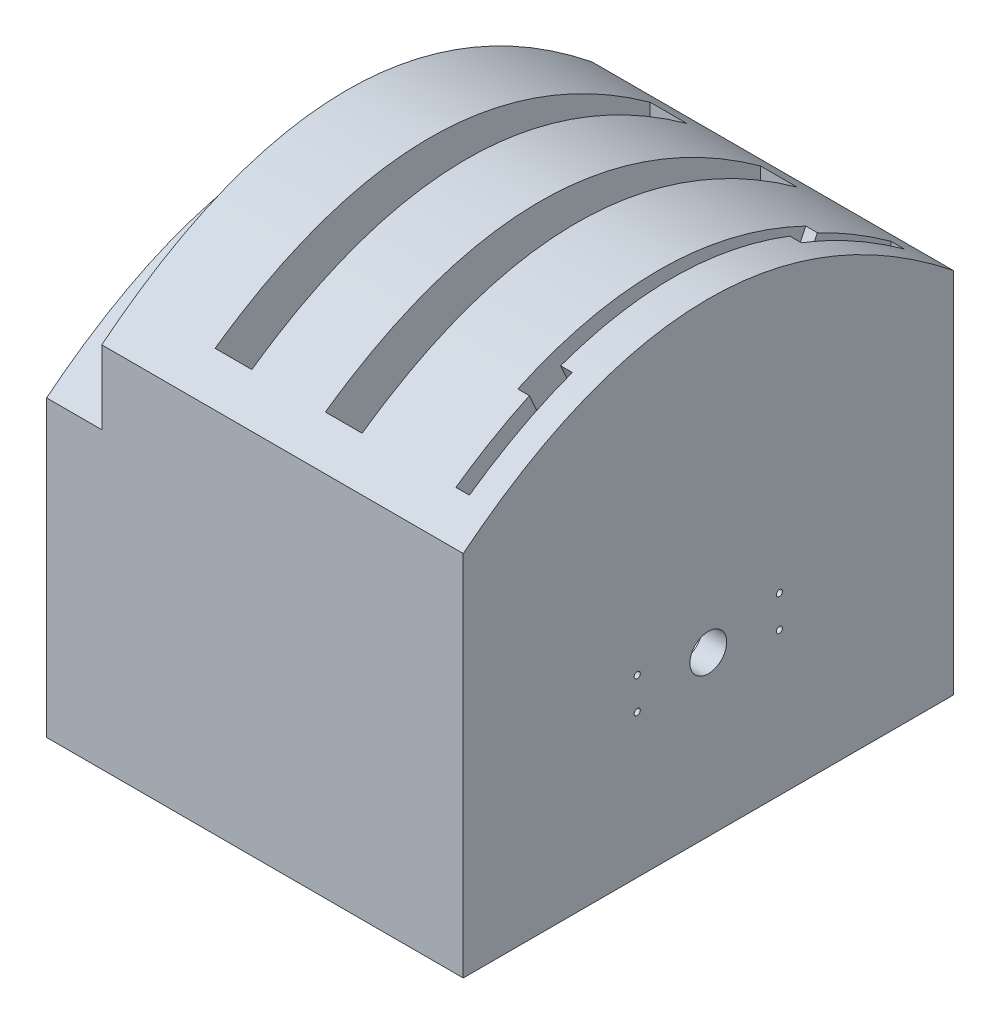
from build123d import *

# Parameters (mm, degrees)
BASE_DEPTH           = 170
FLAPS_CUT_DEPTH      = 190
SKETCH3_W            = 15
SKETCH3_H            = 177.5
THROTTLE_CUT_DEPTH   = 190
SKETCH4_W            = 12.5
SKETCH4_H            = 175
WING_SWEEP_CUT_DEPTH = 190
SKETCH7_W            = 150
SKETCH7_H            = 177.5
BOTTOM_CUT_DEPTH     = 140
CUT_EXTRUDE1_START   = -170
SKETCH6_R            = 7.5
CUT_EXTRUDE1_DEPTH   = 10
SKETCH8_R            = 1.25
CUT_EXTRUDE3_DEPTH   = 10
CUT_EXTRUDE10_DEPTH  = 4.75
BOSS_EXTRUDE5_START  = 10.25
BOSS_EXTRUDE5_DEPTH  = 4.75
CUT_EXTRUDE4_REACH   = 235.506
SKETCH13_W           = 10
SKETCH13_H           = 177.5
BOSS_EXTRUDE2_DEPTH  = 140
BOSS_EXTRUDE1_DEPTH  = 2.5
CUT_EXTRUDE5_START   = 12.5
SKETCH10_R           = 7.5
CUT_EXTRUDE5_DEPTH   = 10
SKETCH14_R           = 5
CUT_EXTRUDE6_DEPTH   = 10
SKETCH16_R           = 1.25
CUT_EXTRUDE9_DEPTH   = 10
BOSS_EXTRUDE3_DEPTH  = 2.5
BOSS_EXTRUDE4_DEPTH  = 2.5
FILLET1_R            = 2.5


with BuildPart() as part:
    # Sketch1 → Base (new body)
    with BuildSketch(Plane(origin=(0, 0, 0), x_dir=(0, 0, -1), z_dir=(1, 0, 0))):
        with BuildLine():
            Line((-100, 85), (-100, -65))
            Line((-100, -65), (100, -65))
            Line((100, -65), (100, 85))
            add(Edge.make_bspline(
                [(-100, 85), (0, 165), (100, 85)],
                knots=[0, 0, 0, 1, 1, 1], degree=2))
        make_face()
    extrude(amount=BASE_DEPTH)

    # Sketch5 → Flaps Cut (cut)
    with BuildSketch(Plane(origin=(0, 125, 0), x_dir=(1, 0, 0), z_dir=(0, 1, 0))):
        Polygon((160, 90), (154.5, 90), (154.5, 60), (149.75, 60), (149.75, -57.5), (154.5, -57.5), (154.5, -87.5), (160, -87.5), (160, -45.5), (155.25, -45.5), (155.25, 48), (160, 48), align=None)
    extrude(amount=-FLAPS_CUT_DEPTH, mode=Mode.SUBTRACT)

    # Sketch3 → Throttle Cut (cut)
    with BuildSketch(Plane(origin=(0, 125, 0), x_dir=(1, 0, 0), z_dir=(0, 1, 0))):
        with Locations((108.75, 1.25)):
            Rectangle(SKETCH3_W, SKETCH3_H)
        with Locations((63.75, 1.25)):
            Rectangle(SKETCH3_W, SKETCH3_H)
    extrude(amount=-THROTTLE_CUT_DEPTH, mode=Mode.SUBTRACT)

    # Sketch4 → Wing Sweep Cut (cut)
    with BuildSketch(Plane(origin=(0, 125, 0), x_dir=(1, 0, 0), z_dir=(0, 1, 0))):
        with Locations((16.25, 0)):
            Rectangle(SKETCH4_W, SKETCH4_H)
    extrude(amount=-WING_SWEEP_CUT_DEPTH, mode=Mode.SUBTRACT)

    # Sketch7 → Bottom Cut (cut)
    with BuildSketch(Plane.XZ.offset(65)):
        with Locations((85, -1.25)):
            Rectangle(SKETCH7_W, SKETCH7_H)
    extrude(amount=-BOTTOM_CUT_DEPTH, mode=Mode.SUBTRACT)

    # Sketch6 → Cut-Extrude1 (cut)
    with BuildSketch(Plane.ZY.offset(CUT_EXTRUDE1_START)):
        with Locations(Location((0, 0, 0), (0, 0, 180))):
            Circle(SKETCH6_R)
    extrude(amount=CUT_EXTRUDE1_DEPTH, mode=Mode.SUBTRACT)

    # Sketch8 → Cut-Extrude3 (cut)
    with BuildSketch(Plane(origin=(170, 0, 0), x_dir=(0, 0, -1), z_dir=(1, 0, 0))):
        with Locations((-29, 6.5)):
            Circle(SKETCH8_R)
        with Locations((29, 6.5)):
            Circle(SKETCH8_R)
        with Locations(Location((29, -6.5, 0), (0, 0, 180))):
            Circle(SKETCH8_R)
        with Locations(Location((-29, -6.5, 0), (0, 0, 180))):
            Circle(SKETCH8_R)
    extrude(amount=-CUT_EXTRUDE3_DEPTH, mode=Mode.SUBTRACT)

    # Sketch20 → Cut-Extrude10 (cut)
    with BuildSketch(Plane.ZY.offset(-155.25)):
        Polygon((45.5, 116.719), (23, 66.719), (45.5, 66.719), align=None)
        Polygon((-48, 115.784), (-48, 65.784), (-24.5, 65.784), align=None)
    extrude(amount=-CUT_EXTRUDE10_DEPTH, mode=Mode.SUBTRACT)

    # Sketch22 → Boss-Extrude5 (add)
    with BuildSketch(Plane.ZY.offset(-160).offset(BOSS_EXTRUDE5_START)):
        Polygon((-60, 110.6), (-43, 75), (-60, 75), align=None)
        Polygon((57.5, 111.775), (57.5, 75), (41.25, 75), align=None)
    extrude(amount=-BOSS_EXTRUDE5_DEPTH)

    # Cut-Extrude4: up to this face of the body (flat: up to its plane)
    cut_extrude4_end = Plane(part.part.faces().sort_by_distance((22.5, 95.943389409, 0))[0])
    # Sketch9 → Cut-Extrude4 (cut, up to the picked face)
    with BuildSketch(Plane.ZY, mode=Mode.PRIVATE) as cut_extrude4_sk1:
        with BuildLine():
            Line((-100, 55), (-100, 135))
            Line((-100, 135), (100, 135))
            Line((100, 135), (100, 55))
            add(Edge.make_bspline(
                [(-100, 55), (0, 135), (100, 55)],
                knots=[0, 0, 0, 1, 1, 1], degree=2))
        make_face()
    cut_extrude4_tool1 = split(extrude(cut_extrude4_sk1.sketch, amount=-CUT_EXTRUDE4_REACH, mode=Mode.PRIVATE), bisect_by=cut_extrude4_end, keep=Keep.BOTH, mode=Mode.PRIVATE)
    add(cut_extrude4_tool1.solids().sort_by(Axis((0, 107, 0), (1, 0, 0)))[0], mode=Mode.SUBTRACT)

    # Sketch13 → Boss-Extrude2 (add)
    with BuildSketch(Plane.XZ.offset(-75)):
        with Locations((27.5, -1.25)):
            Rectangle(SKETCH13_W, SKETCH13_H)
    extrude(amount=BOSS_EXTRUDE2_DEPTH)

    # Sketch12 → Boss-Extrude1 (add)
    with BuildSketch(Plane.ZY.offset(-22.5)):
        with BuildLine():
            Line((-48.430896929, 58.27583397), (-48.430896929, 55.27583397))
            add(Edge.make_bspline(
                [(100, 24.75), (53.034936091, 64.414476941), (3.557970448, 74.589754931), (-48.430896929, 55.27583397)],
                knots=[0, 0, 0, 0, 0.968984133, 0.968984133, 0.968984133, 0.968984133], degree=3))
            Line((100, 24.75), (100, 27.75))
            add(Edge.make_bspline(
                [(-48.430896929, 58.27583397), (3.557970448, 77.589754931), (53.034936091, 67.414476941), (100, 27.75)],
                knots=[0.031015867, 0.031015867, 0.031015867, 0.031015867, 1, 1, 1, 1], degree=3))
        make_face()
    extrude(amount=BOSS_EXTRUDE1_DEPTH)

    # Sketch10 → Cut-Extrude5 (cut)
    with BuildSketch(Plane(origin=(10, 0, 0), x_dir=(0, 0, -1), z_dir=(1, 0, 0)).offset(CUT_EXTRUDE5_START)):
        with Locations(Location((0, -30, 0), (0, 0, 180))):
            Circle(SKETCH10_R)
    extrude(amount=CUT_EXTRUDE5_DEPTH, mode=Mode.SUBTRACT)

    # Sketch14 → Cut-Extrude6 (cut)
    with BuildSketch(Plane.ZY.offset(-22.5)):
        with Locations((47.461085944, -24.937811516)):
            Circle(SKETCH14_R)
    extrude(amount=-CUT_EXTRUDE6_DEPTH, mode=Mode.SUBTRACT)

    # Sketch16 → Cut-Extrude9 (cut)
    with BuildSketch(Plane.ZY.offset(-22.5)):
        with Locations((80, -55)):
            Circle(SKETCH16_R)
        with Locations((15, -55)):
            Circle(SKETCH16_R)
        with Locations(Location((15, 0, 0), (0, 0, 180))):
            Circle(SKETCH16_R)
        with Locations(Location((80, 0, 0), (0, 0, 180))):
            Circle(SKETCH16_R)
    extrude(amount=-CUT_EXTRUDE9_DEPTH, mode=Mode.SUBTRACT)

    # Sketch17 → Boss-Extrude3 (add)
    with BuildSketch(Plane.ZY.offset(-22.5)):
        Polygon((-49.779698587, 57.845518251), (-56.564154309, 70.770998519), (-59.220468232, 69.376725826), (-51.087210852, 53.881561277), (-48.430896929, 55.27583397), (-48.430896929, 58.27583397), align=None)
    extrude(amount=BOSS_EXTRUDE3_DEPTH)

    # Sketch19 → Boss-Extrude4 (add)
    with BuildSketch(Plane.ZY.offset(-22.5)):
        with BuildLine():
            Line((-55.75633725, 69.231976984), (-56.913289215, 71.693559969))
            add(Edge.make_bspline(
                [(-100, 45.5), (-77.538087055, 61.999838272), (-56.913289215, 71.693559969)],
                knots=[0, 0, 0, 0.206247978, 0.206247978, 0.206247978], degree=2))
            Line((-100, 45.5), (-100, 42.5))
            add(Edge.make_bspline(
                [(-100, 42.5), (-76.959611073, 59.462619059), (-55.75633725, 69.231976984)],
                knots=[0, 0, 0, 0.212032738, 0.212032738, 0.212032738], degree=2))
        make_face()
    extrude(amount=BOSS_EXTRUDE4_DEPTH)

    # Fillet1
    fillet1_edges = [part.edges().sort_by_distance(p)[0] for p in [
        (21.25, 53.881561277, -51.087210852),
        (21.25, 57.845518251, -49.779698587),
        (21.25, 67.954035681, -58.473712359),
        (21.25, 71.693559969, -56.913289215),
    ]]
    fillet(fillet1_edges, radius=FILLET1_R)


solid = part.part
